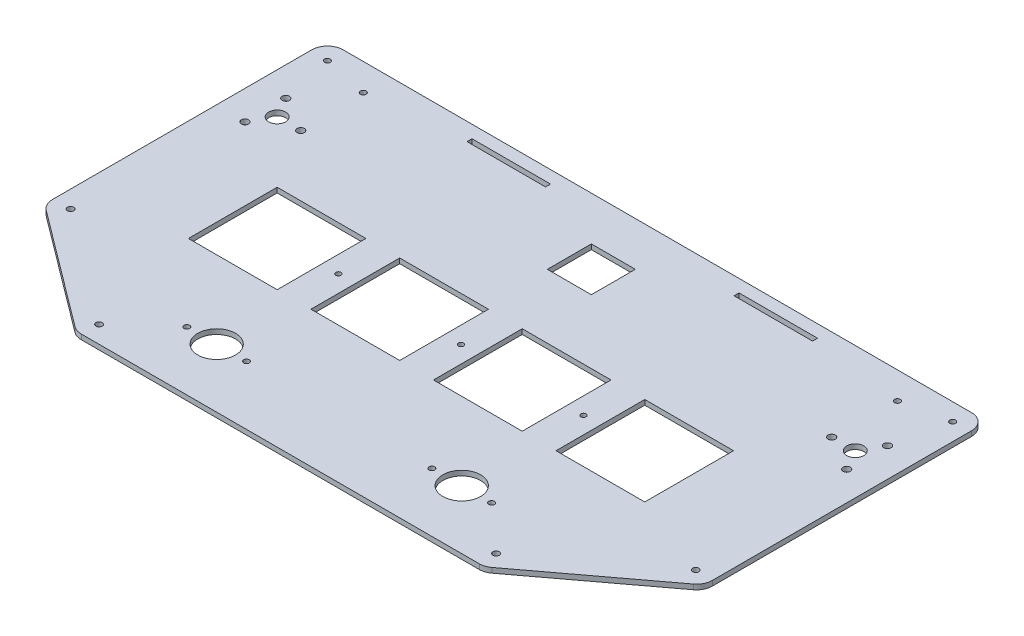
from build123d import *

# Parameters (mm, degrees)
SKETCH1_W           = 420
SKETCH1_H           = 240
SKETCH1_R           = 2.316650795
SKETCH1_R_2         = 5.401558945
SKETCH1_R_3         = 12
SKETCH1_R_4         = 1.8
SKETCH1_W_2         = 56.5
SKETCH1_H_2         = 56.5
SKETCH1_W_3         = 28
SKETCH1_H_3         = 28
BOSS_EXTRUDE1_DEPTH = 3.175
CUT_EXTRUDE1_DEPTH  = 10
FILLET1_R           = 10
SKETCH5_R           = 1.83
SKETCH5_R_2         = 2
SKETCH5_R_3         = 1.66
CUT_EXTRUDE2_DEPTH  = 3.175
SKETCH6_W           = 50
SKETCH6_H           = 3.175
CUT_EXTRUDE3_DEPTH  = 3.175


with BuildPart() as part:
    # Sketch1 → Boss-Extrude1 (new body)
    with BuildSketch(Plane(origin=(0, 0, 0), x_dir=(1, 0, 0), z_dir=(0, 1, 0))):
        with Locations((210, 120)):
            Rectangle(SKETCH1_W, SKETCH1_H)
        with Locations(Location((41, 182, 0), (0, 0, 270))):
            Circle(SKETCH1_R, mode=Mode.SUBTRACT)
        with Locations(Location((18.5, 169.009618943, 0), (0, 0, 270))):
            Circle(SKETCH1_R, mode=Mode.SUBTRACT)
        with Locations(Location((18.5, 194.990381057, 0), (0, 0, 270))):
            Circle(SKETCH1_R, mode=Mode.SUBTRACT)
        with Locations(Location((26, 182, 0), (0, 0, 270))):
            Circle(SKETCH1_R_2, mode=Mode.SUBTRACT)
        with Locations(Location((132, 37.5, 0), (0, 0, 270))):
            Circle(SKETCH1_R_3, mode=Mode.SUBTRACT)
        with Locations(Location((113, 37.5, 0), (0, 0, 270))):
            Circle(SKETCH1_R_4, mode=Mode.SUBTRACT)
        with Locations(Location((151, 37.5, 0), (0, 0, 270))):
            Circle(SKETCH1_R_4, mode=Mode.SUBTRACT)
        with Locations(Location((401.5, 194.990381057, 0), (0, 0, 90))):
            Circle(SKETCH1_R, mode=Mode.SUBTRACT)
        with Locations(Location((379, 182, 0), (0, 0, 90))):
            Circle(SKETCH1_R, mode=Mode.SUBTRACT)
        with Locations(Location((394, 182, 0), (0, 0, 90))):
            Circle(SKETCH1_R_2, mode=Mode.SUBTRACT)
        with Locations(Location((401.5, 169.009618943, 0), (0, 0, 90))):
            Circle(SKETCH1_R, mode=Mode.SUBTRACT)
        with Locations(Location((307, 37.5, 0), (0, 0, 90))):
            Circle(SKETCH1_R_4, mode=Mode.SUBTRACT)
        with Locations(Location((269, 37.5, 0), (0, 0, 90))):
            Circle(SKETCH1_R_4, mode=Mode.SUBTRACT)
        with Locations(Location((288, 37.5, 0), (0, 0, 90))):
            Circle(SKETCH1_R_3, mode=Mode.SUBTRACT)
        with Locations((171, 115)):
            Rectangle(SKETCH1_W_2, SKETCH1_H_2, mode=Mode.SUBTRACT)
        with Locations((93, 115)):
            Rectangle(SKETCH1_W_2, SKETCH1_H_2, mode=Mode.SUBTRACT)
        with Locations((327, 115)):
            Rectangle(SKETCH1_W_2, SKETCH1_H_2, mode=Mode.SUBTRACT)
        with Locations((249, 115)):
            Rectangle(SKETCH1_W_2, SKETCH1_H_2, mode=Mode.SUBTRACT)
        with Locations((210, 198)):
            Rectangle(SKETCH1_W_3, SKETCH1_H_3, mode=Mode.SUBTRACT)
    extrude(amount=BOSS_EXTRUDE1_DEPTH)

    # Sketch2 → Cut-Extrude1 (cut)
    with BuildSketch(Plane(origin=(0, 3.175, 0), x_dir=(1, 0, 0), z_dir=(0, 1, 0))):
        Polygon((0, 60), (0, 0), (80, 0), align=None)
        Polygon((420, 60), (420, 0), (340, 0), align=None)
    extrude(amount=-CUT_EXTRUDE1_DEPTH, mode=Mode.SUBTRACT)

    # Fillet1
    fillet1_edges = [part.edges().sort_by_distance(p)[0] for p in [
        (420, 1.5875, -60),
        (80, 1.5875, 0),
        (0, 1.5875, -60),
        (340, 1.5875, 0),
        (0, 1.5875, -240),
        (420, 1.5875, -240),
    ]]
    fillet(fillet1_edges, radius=FILLET1_R)

    # Sketch5 → Cut-Extrude2 (cut)
    with BuildSketch(Plane(origin=(0, 3.175, 0), x_dir=(1, 0, 0), z_dir=(0, 1, 0))):
        with Locations(Location((11, 229, 0), (0, 0, 270))):
            Circle(SKETCH5_R)
        with Locations(Location((11, 65.5, 0), (0, 0, 270))):
            Circle(SKETCH5_R_2)
        with Locations(Location((83.666666667, 11, 0), (0, 0, 270))):
            Circle(SKETCH5_R_2)
        with Locations(Location((409, 65.5, 0), (0, 0, 90))):
            Circle(SKETCH5_R_2)
        with Locations(Location((336.333333333, 11, 0), (0, 0, 90))):
            Circle(SKETCH5_R_2)
        with Locations(Location((210, 115, 0), (0, 0, 270))):
            Circle(SKETCH5_R_3)
        with Locations(Location((132, 115, 0), (0, 0, 270))):
            Circle(SKETCH5_R_3)
        with Locations(Location((288, 115, 0), (0, 0, 270))):
            Circle(SKETCH5_R_3)
        with Locations(Location((40, 222.825, 0), (0, 0, 270))):
            Circle(SKETCH5_R)
        with Locations(Location((380, 222.825, 0), (0, 0, 90))):
            Circle(SKETCH5_R)
        with Locations(Location((409, 229, 0), (0, 0, 90))):
            Circle(SKETCH5_R)
    extrude(amount=-CUT_EXTRUDE2_DEPTH, mode=Mode.SUBTRACT)

    # Sketch6 → Cut-Extrude3 (cut)
    with BuildSketch(Plane(origin=(0, 3.175, 0), x_dir=(1, 0, 0), z_dir=(0, 1, 0))):
        with Locations((125, 230.4125)):
            Rectangle(SKETCH6_W, SKETCH6_H)
        with Locations((295, 230.4125)):
            Rectangle(SKETCH6_W, SKETCH6_H)
    extrude(amount=-CUT_EXTRUDE3_DEPTH, mode=Mode.SUBTRACT)


solid = part.part
